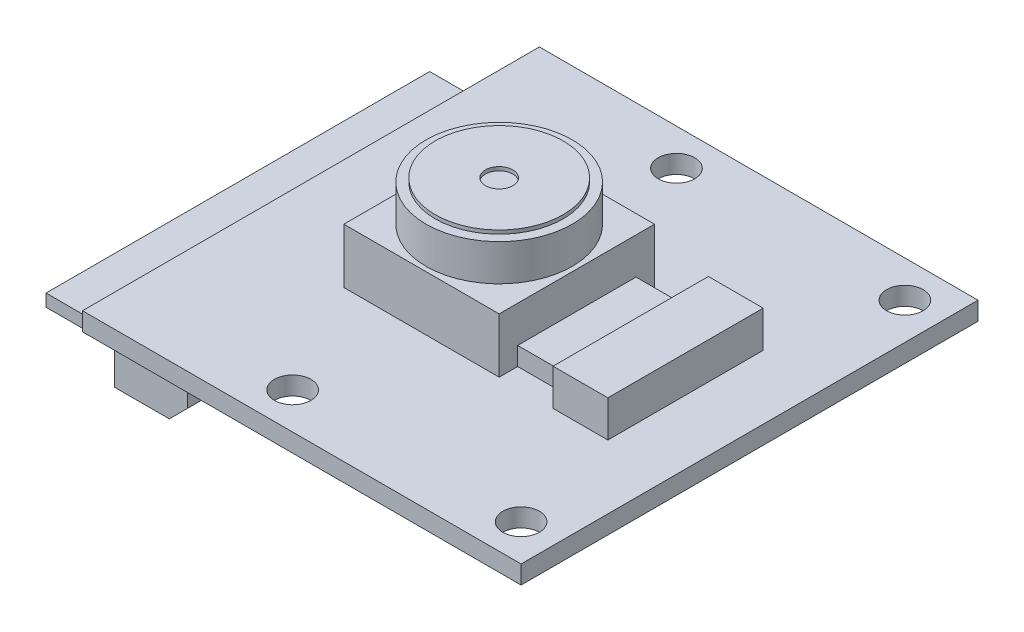
from build123d import *

# Parameters (mm, degrees)
SKETCH_1_W          = 24
SKETCH_1_H          = 25
EXTRUDE_1_DEPTH     = 1
SKETCH_2_W          = 8.5
SKETCH_2_H          = 8.5
EXTRUDE_2_DEPTH     = 3
SKETCH_3_R          = 4
EXTRUDE_3_DEPTH     = 2
SKETCH_4_W          = 3
SKETCH_4_H          = 8.5
EXTRUDE_4_DEPTH     = 2
SKETCH_5_W          = 2.95
SKETCH_5_H          = 6.47612255
EXTRUDE_5_DEPTH     = 1
SKETCH_6_W          = 4
SKETCH_6_H          = 23.5
EXTRUDE_6_DEPTH     = 2.5
CHAMFER_1_SIZE      = 1
SKETCH_7_W          = 20.993550262
SKETCH_7_H          = 0.673046144
EXTRUDE_7_DEPTH     = 5
SKETCH_8_R          = 1
CUT_EXTRUDE_1_DEPTH = 1
SKETCH_9_R          = 3.5
EXTRUDE_8_DEPTH     = 0.2
SKETCH_10_R         = 0.75
CUT_EXTRUDE_2_DEPTH = 0.2


with BuildPart() as part:
    # 草图1 → 凸台-拉伸1 (new body)
    with BuildSketch(Plane(origin=(0, 0, 0), x_dir=(1, 0, 0), z_dir=(0, 1, 0))):
        Rectangle(SKETCH_1_W, SKETCH_1_H)
    extrude(amount=EXTRUDE_1_DEPTH)

    # 草图2 → 凸台-拉伸2 (add)
    with BuildSketch(Plane(origin=(0, 1, 0), x_dir=(1, 0, 0), z_dir=(0, 1, 0))):
        with Locations((-1.7, 0)):
            Rectangle(SKETCH_2_W, SKETCH_2_H)
    extrude(amount=EXTRUDE_2_DEPTH)

    # 草图3 → 凸台-拉伸3 (add)
    with BuildSketch(Plane(origin=(0, 4, 0), x_dir=(1, 0, 0), z_dir=(0, 1, 0))):
        with Locations(Location((-1.7, 0, 0), (0, 0, 270))):
            Circle(SKETCH_3_R)
    extrude(amount=EXTRUDE_3_DEPTH)

    # 草图4 → 凸台-拉伸4 (add)
    with BuildSketch(Plane(origin=(0, 1, 0), x_dir=(1, 0, 0), z_dir=(0, 1, 0))):
        with Locations((7, -0.004190874)):
            Rectangle(SKETCH_4_W, SKETCH_4_H)
    extrude(amount=EXTRUDE_4_DEPTH)

    # 草图5 → 凸台-拉伸5 (add)
    with BuildSketch(Plane(origin=(0, 1, 0), x_dir=(1, 0, 0), z_dir=(0, 1, 0))):
        with Locations((4.025, 0)):
            Rectangle(SKETCH_5_W, SKETCH_5_H)
    extrude(amount=EXTRUDE_5_DEPTH)

    # 草图6 → 凸台-拉伸6 (add)
    with BuildSketch(Plane(origin=(0, 0, 0), x_dir=(1, 0, 0), z_dir=(0, 1, 0))):
        with Locations((-9, 0)):
            Rectangle(SKETCH_6_W, SKETCH_6_H)
    extrude(amount=-EXTRUDE_6_DEPTH)

    # 倒角1
    chamfer_1_edges = [part.edges().sort_by_distance(p)[0] for p in [
        (-7, -2.5, 0),
    ]]
    chamfer(chamfer_1_edges, length=CHAMFER_1_SIZE)

    # 草图7 → 凸台-拉伸7 (add)
    with BuildSketch(Plane.ZY.offset(11)):
        with Locations((0, -1.5)):
            Rectangle(SKETCH_7_W, SKETCH_7_H)
    extrude(amount=EXTRUDE_7_DEPTH)

    # 草图8 → 切除-拉伸1 (cut)
    with BuildSketch(Plane(origin=(0, 1, 0), x_dir=(1, 0, 0), z_dir=(0, 1, 0))):
        with Locations(Location((10, -10.5, 0), (0, 0, 270))):
            Circle(SKETCH_8_R)
        with Locations(Location((10, 10.5, 0), (0, 0, 270))):
            Circle(SKETCH_8_R)
        with Locations(Location((-2.5, -10.5, 0), (0, 0, 270))):
            Circle(SKETCH_8_R)
        with Locations(Location((-2.5, 10.5, 0), (0, 0, 270))):
            Circle(SKETCH_8_R)
    extrude(amount=-CUT_EXTRUDE_1_DEPTH, mode=Mode.SUBTRACT)

    # 草图9 → 凸台-拉伸8 (add)
    with BuildSketch(Plane(origin=(0, 6, 0), x_dir=(1, 0, 0), z_dir=(0, 1, 0))):
        with Locations(Location((-1.7, 0, 0), (0, 0, 270))):
            Circle(SKETCH_9_R)
    extrude(amount=EXTRUDE_8_DEPTH)

    # 草图10 → 切除-拉伸2 (cut)
    with BuildSketch(Plane(origin=(0, 6.2, 0), x_dir=(1, 0, 0), z_dir=(0, 1, 0))):
        with Locations(Location((-1.7, 0, 0), (0, 0, 270))):
            Circle(SKETCH_10_R)
    extrude(amount=-CUT_EXTRUDE_2_DEPTH, mode=Mode.SUBTRACT)


solid = part.part
